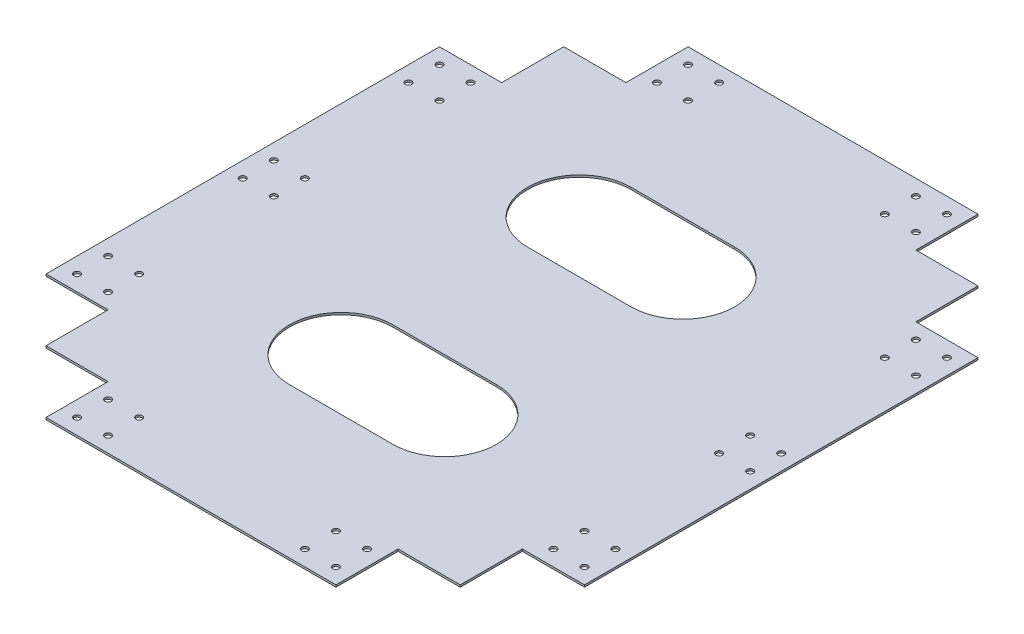
from build123d import *

# Parameters (mm, degrees)
SKETCH_1_R      = 3.1
EXTRUDE_1_DEPTH = 2


with BuildPart() as part:
    # 草图1 → 凸台-拉伸1 (new body)
    with BuildSketch(Plane(origin=(0, 0, 0), x_dir=(1, 0, 0), z_dir=(0, 1, 0))):
        Polygon((-187.609763817, 175.878092516), (-187.609763817, 235.878092516), (-127.609763817, 235.878092516), (-127.609763817, 295.878092516), (152.390236183, 295.878092516), (152.390236183, 235.878092516), (212.390236183, 235.878092516), (212.390236183, 175.878092516), (272.390236183, 175.878092516), (272.390236183, -204.121907484), (212.390236183, -204.121907484), (212.390236183, -264.121907484), (152.390236183, -264.121907484), (152.390236183, -324.121907484), (-127.609763817, -324.121907484), (-127.609763817, -264.121907484), (-187.609763817, -264.121907484), (-187.609763817, -204.121907484), (-247.609763817, -204.121907484), (-247.609763817, 175.878092516), align=None)
        with Locations(Location((-112.609763817, -279.121907484, 0), (0, 0, 270))):
            Circle(SKETCH_1_R, mode=Mode.SUBTRACT)
        with Locations(Location((-82.609763817, -279.121907484, 0), (0, 0, 270))):
            Circle(SKETCH_1_R, mode=Mode.SUBTRACT)
        with Locations(Location((-112.609763817, -309.121907484, 0), (0, 0, 270))):
            Circle(SKETCH_1_R, mode=Mode.SUBTRACT)
        with Locations(Location((-82.609763817, -309.121907484, 0), (0, 0, 270))):
            Circle(SKETCH_1_R, mode=Mode.SUBTRACT)
        with Locations(Location((-232.609763817, -159.121907484, 0), (0, 0, 270))):
            Circle(SKETCH_1_R, mode=Mode.SUBTRACT)
        with Locations(Location((-202.609763817, -159.121907484, 0), (0, 0, 270))):
            Circle(SKETCH_1_R, mode=Mode.SUBTRACT)
        with Locations(Location((-232.609763817, -189.121907484, 0), (0, 0, 270))):
            Circle(SKETCH_1_R, mode=Mode.SUBTRACT)
        with Locations(Location((-202.609763817, -189.121907484, 0), (0, 0, 270))):
            Circle(SKETCH_1_R, mode=Mode.SUBTRACT)
        with Locations(Location((257.390236183, -189.121907484, 0), (0, 0, 270))):
            Circle(SKETCH_1_R, mode=Mode.SUBTRACT)
        with Locations(Location((227.390236183, -189.121907484, 0), (0, 0, 270))):
            Circle(SKETCH_1_R, mode=Mode.SUBTRACT)
        with Locations(Location((227.390236183, -159.121907484, 0), (0, 0, 270))):
            Circle(SKETCH_1_R, mode=Mode.SUBTRACT)
        with Locations(Location((257.390236183, -159.121907484, 0), (0, 0, 270))):
            Circle(SKETCH_1_R, mode=Mode.SUBTRACT)
        with Locations(Location((227.390236183, 160.878092516, 0), (0, 0, 270))):
            Circle(SKETCH_1_R, mode=Mode.SUBTRACT)
        with Locations(Location((257.390236183, 160.878092516, 0), (0, 0, 270))):
            Circle(SKETCH_1_R, mode=Mode.SUBTRACT)
        with Locations(Location((257.390236183, 130.878092516, 0), (0, 0, 270))):
            Circle(SKETCH_1_R, mode=Mode.SUBTRACT)
        with Locations(Location((227.390236183, 130.878092516, 0), (0, 0, 270))):
            Circle(SKETCH_1_R, mode=Mode.SUBTRACT)
        with Locations(Location((-232.609763817, 160.878092516, 0), (0, 0, 270))):
            Circle(SKETCH_1_R, mode=Mode.SUBTRACT)
        with Locations(Location((-202.609763817, 160.878092516, 0), (0, 0, 270))):
            Circle(SKETCH_1_R, mode=Mode.SUBTRACT)
        with Locations(Location((-202.609763817, 130.878092516, 0), (0, 0, 270))):
            Circle(SKETCH_1_R, mode=Mode.SUBTRACT)
        with Locations(Location((-232.609763817, 130.878092516, 0), (0, 0, 270))):
            Circle(SKETCH_1_R, mode=Mode.SUBTRACT)
        with Locations(Location((-232.609763817, 0.878092516, 0), (0, 0, 270))):
            Circle(SKETCH_1_R, mode=Mode.SUBTRACT)
        with Locations(Location((-202.609763817, 0.878092516, 0), (0, 0, 270))):
            Circle(SKETCH_1_R, mode=Mode.SUBTRACT)
        with Locations(Location((-202.609763817, -29.121907484, 0), (0, 0, 270))):
            Circle(SKETCH_1_R, mode=Mode.SUBTRACT)
        with Locations(Location((-232.609763817, -29.121907484, 0), (0, 0, 270))):
            Circle(SKETCH_1_R, mode=Mode.SUBTRACT)
        with Locations(Location((257.390236183, -29.121907484, 0), (0, 0, 270))):
            Circle(SKETCH_1_R, mode=Mode.SUBTRACT)
        with Locations(Location((227.390236183, -29.121907484, 0), (0, 0, 270))):
            Circle(SKETCH_1_R, mode=Mode.SUBTRACT)
        with Locations(Location((227.390236183, 0.878092516, 0), (0, 0, 270))):
            Circle(SKETCH_1_R, mode=Mode.SUBTRACT)
        with Locations(Location((257.390236183, 0.878092516, 0), (0, 0, 270))):
            Circle(SKETCH_1_R, mode=Mode.SUBTRACT)
        with Locations(Location((137.390236183, -309.121907484, 0), (0, 0, 270))):
            Circle(SKETCH_1_R, mode=Mode.SUBTRACT)
        with Locations(Location((107.390236183, -309.121907484, 0), (0, 0, 270))):
            Circle(SKETCH_1_R, mode=Mode.SUBTRACT)
        with Locations(Location((107.390236183, -279.121907484, 0), (0, 0, 270))):
            Circle(SKETCH_1_R, mode=Mode.SUBTRACT)
        with Locations(Location((137.390236183, -279.121907484, 0), (0, 0, 270))):
            Circle(SKETCH_1_R, mode=Mode.SUBTRACT)
        with Locations(Location((107.390236183, 280.878092516, 0), (0, 0, 270))):
            Circle(SKETCH_1_R, mode=Mode.SUBTRACT)
        with Locations(Location((137.390236183, 280.878092516, 0), (0, 0, 270))):
            Circle(SKETCH_1_R, mode=Mode.SUBTRACT)
        with Locations(Location((137.390236183, 250.878092516, 0), (0, 0, 270))):
            Circle(SKETCH_1_R, mode=Mode.SUBTRACT)
        with Locations(Location((107.390236183, 250.878092516, 0), (0, 0, 270))):
            Circle(SKETCH_1_R, mode=Mode.SUBTRACT)
        with Locations(Location((-112.609763817, 280.878092516, 0), (0, 0, 270))):
            Circle(SKETCH_1_R, mode=Mode.SUBTRACT)
        with Locations(Location((-82.609763817, 280.878092516, 0), (0, 0, 270))):
            Circle(SKETCH_1_R, mode=Mode.SUBTRACT)
        with Locations(Location((-82.609763817, 250.878092516, 0), (0, 0, 270))):
            Circle(SKETCH_1_R, mode=Mode.SUBTRACT)
        with Locations(Location((-112.609763817, 250.878092516, 0), (0, 0, 270))):
            Circle(SKETCH_1_R, mode=Mode.SUBTRACT)
        with BuildLine():
            Line((-37.609763817, 150.878092516), (62.390236183, 150.878092516))
            ThreePointArc((62.390236183, 150.878092516), (112.390236183, 100.878092516), (62.390236183, 50.878092516))
            Line((62.390236183, 50.878092516), (-37.609763817, 50.878092516))
            ThreePointArc((-37.609763817, 50.878092516), (-87.609763817, 100.878092516), (-37.609763817, 150.878092516))
        make_face(mode=Mode.SUBTRACT)
        with BuildLine():
            Line((-37.609763817, -179.121907484), (62.390236183, -179.121907484))
            ThreePointArc((62.390236183, -179.121907484), (112.390236183, -129.121907484), (62.390236183, -79.121907484))
            Line((62.390236183, -79.121907484), (-37.609763817, -79.121907484))
            ThreePointArc((-37.609763817, -79.121907484), (-87.609763817, -129.121907484), (-37.609763817, -179.121907484))
        make_face(mode=Mode.SUBTRACT)
    extrude(amount=EXTRUDE_1_DEPTH)


solid = part.part
